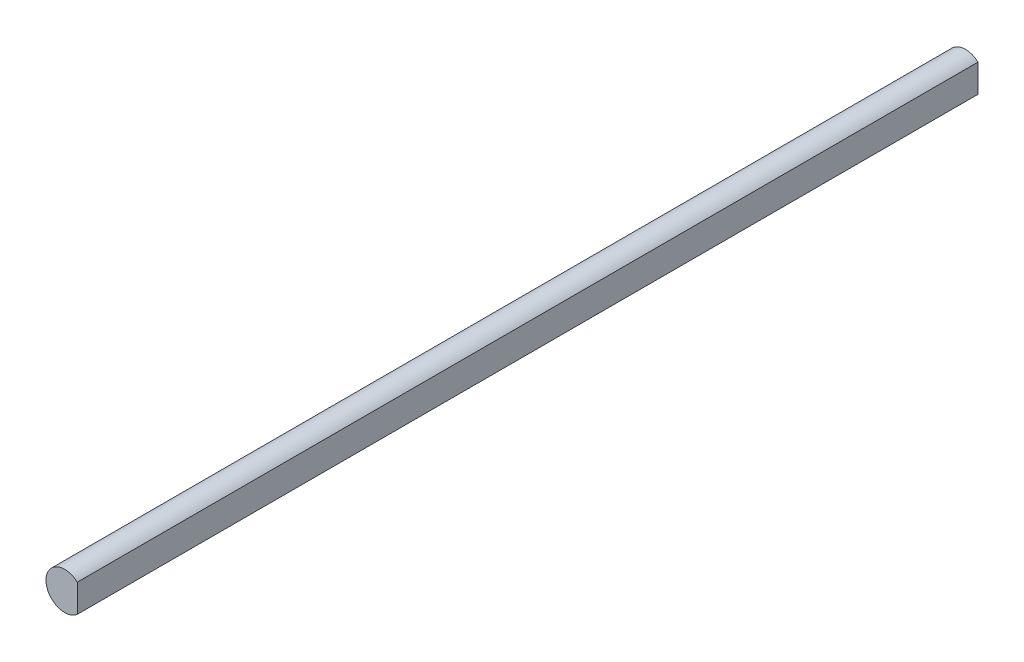
from build123d import *

# Parameters (mm, degrees)
CROQUIS1_R              = 2.5
SALIENTE_EXTRUIR1_DEPTH = 120
CORTAR_EXTRUIR1_DEPTH   = 121.052072035


with BuildPart() as part:
    # Croquis1 → Saliente-Extruir1 (new body)
    with BuildSketch(Plane.XY):
        Circle(CROQUIS1_R)
    extrude(amount=SALIENTE_EXTRUIR1_DEPTH)

    # Croquis2 → Cortar-Extruir1 (cut, through all)
    with BuildSketch(Plane(origin=(0, 0, 0), x_dir=(-1, 0, 0), z_dir=(0, 0, -1))):
        with BuildLine():
            Line((-1.672910403, 1.857786528), (-1.672910403, -1.857786528))
            ThreePointArc((-1.672910403, -1.857786528), (-2.5, 0), (-1.672910403, 1.857786528))
        make_face()
    extrude(amount=-CORTAR_EXTRUIR1_DEPTH, mode=Mode.SUBTRACT)


solid = part.part
